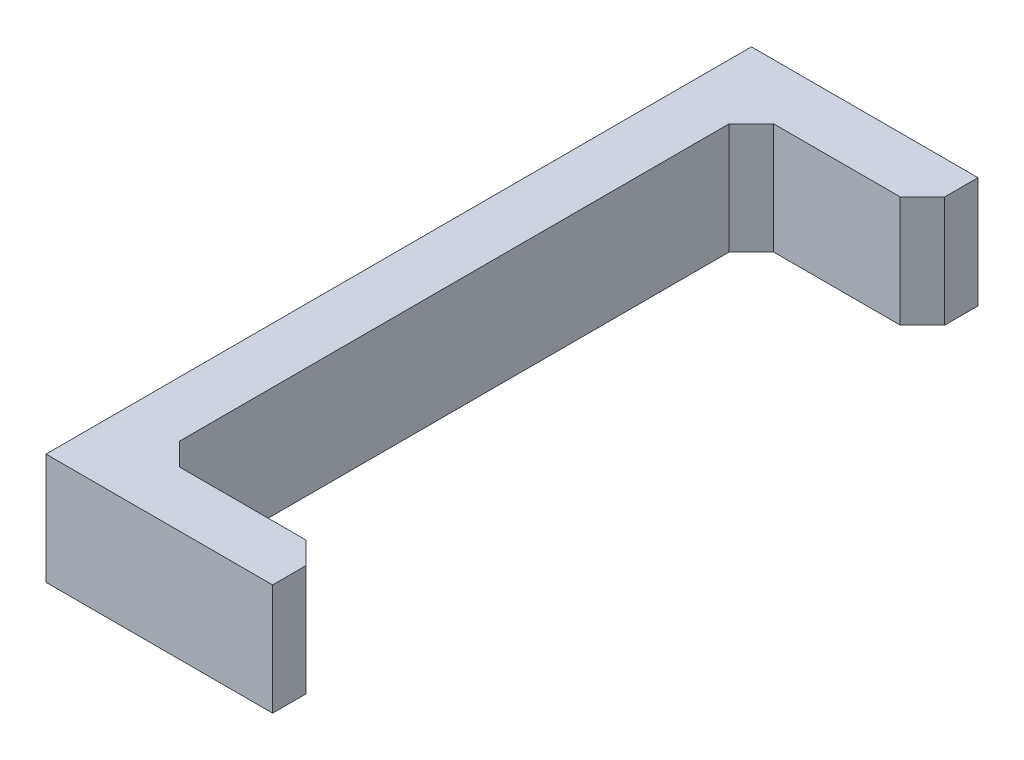
from build123d import *

# Parameters (mm, degrees)
BOSS_EXTRUDE1_DEPTH = 10
CHAMFER1_SIZE       = 2


with BuildPart() as part:
    # Sketch1 → Boss-Extrude1 (new body)
    with BuildSketch(Plane(origin=(0, 0, 0), x_dir=(1, 0, 0), z_dir=(0, 1, 0))):
        Polygon((7.7, 26.75), (-7.7, 26.75), (-7.7, -26.75), (7.7, -26.75), (7.7, -31.75), (-12.7, -31.75), (-12.7, 31.75), (7.7, 31.75), align=None)
    extrude(amount=BOSS_EXTRUDE1_DEPTH)

    # Chamfer1
    chamfer1_edges = [part.edges().sort_by_distance(p)[0] for p in [
        (7.7, 5, -26.75),
        (-7.7, 5, -26.75),
        (-7.7, 5, 26.75),
        (7.7, 5, 26.75),
    ]]
    chamfer(chamfer1_edges, length=CHAMFER1_SIZE)


solid = part.part
